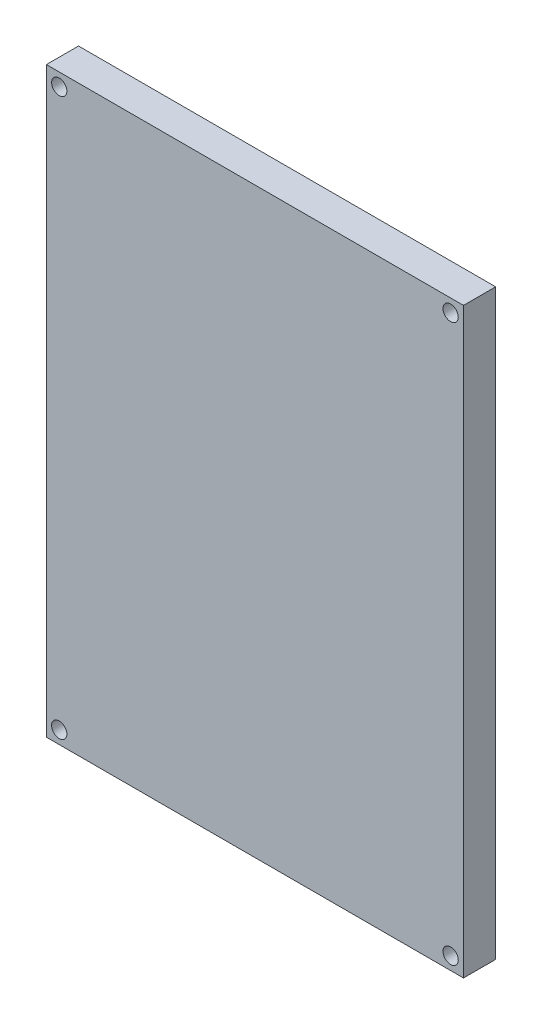
from build123d import *

# Parameters (mm, degrees)
SKETCH_1_W      = 25.95
SKETCH_1_H      = 36.24
EXTRUDE_1_DEPTH = 2
M1_2X0_25_1_D   = 0.95


with BuildPart() as part:
    # 草图1 → 凸台-拉伸1 (new body)
    with BuildSketch(Plane.XY):
        with Locations((12.975, 18.12)):
            Rectangle(SKETCH_1_W, SKETCH_1_H)
    extrude(amount=EXTRUDE_1_DEPTH)

    # M1.2x0.25 螺纹孔1 (through all)
    with Locations(Plane(origin=(0.8, 0.8, 2), x_dir=(1, 0, 0), z_dir=(0, 0, 1))):
        with Locations((0, 0), (24.35, 0), (24.35, 34.64), (0, 34.64)):
            Hole(M1_2X0_25_1_D / 2)


solid = part.part
